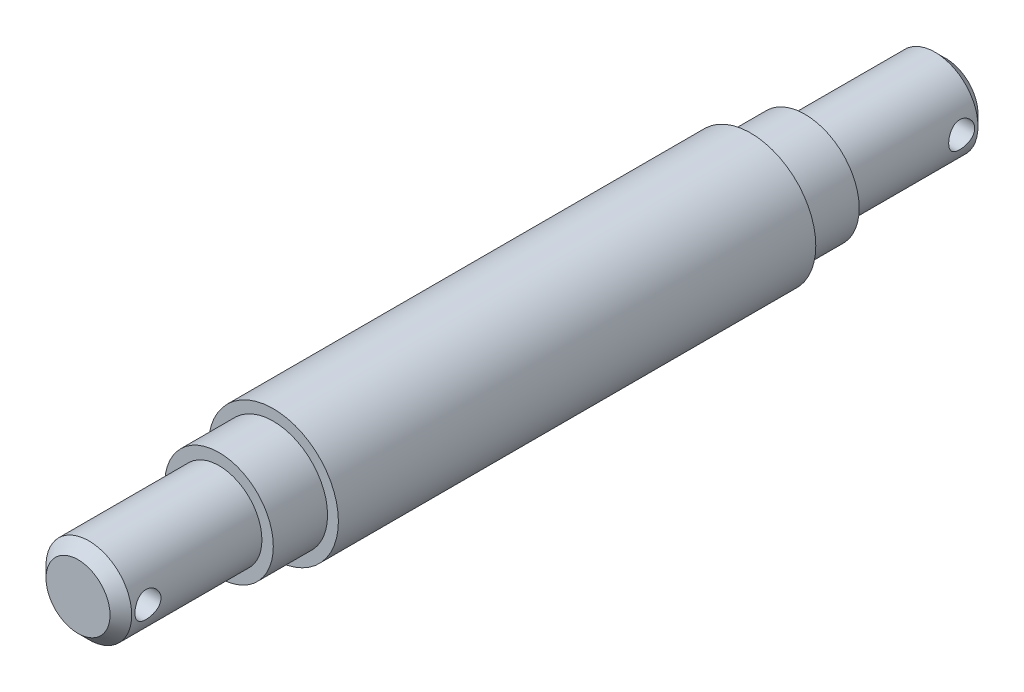
from build123d import *

# Parameters (mm, degrees)
SKETCH1_R           = 6
BOSS_EXTRUDE1_DEPTH = 22
SKETCH2_R           = 5
BOSS_EXTRUDE2_DEPTH = 5
SKETCH3_R           = 3.95
BOSS_EXTRUDE3_DEPTH = 13
SKETCH4_R           = 1.2
CUT_EXTRUDE1_DEPTH  = 6.5
CHAMFER1_SIZE       = 1
CHAMFER2_SIZE       = 1


with BuildPart() as part:
    # Sketch1 → Boss-Extrude1 (new, symmetric)
    with BuildSketch(Plane.XY):
        Circle(SKETCH1_R)
    extrude(amount=BOSS_EXTRUDE1_DEPTH, both=True)

    # Sketch2 → Boss-Extrude2 (add)
    with BuildSketch(Plane.XY.offset(22)):
        Circle(SKETCH2_R)
    boss_extrude2 = extrude(amount=BOSS_EXTRUDE2_DEPTH)

    # Sketch3 → Boss-Extrude3 (add)
    with BuildSketch(Plane.XY.offset(27)):
        with Locations(Location((0, 0, 0), (0, 0, 180))):
            Circle(SKETCH3_R)
    boss_extrude3 = extrude(amount=BOSS_EXTRUDE3_DEPTH)

    # Sketch4 → Cut-Extrude1 (cut, symmetric)
    with BuildSketch(Plane(origin=(0, 0, 0), x_dir=(0, 0, -1), z_dir=(1, 0, 0))):
        with Locations(Location((-37.5, 0, 0), (0, 0, 179.999999999))):
            Circle(SKETCH4_R)
    cut_extrude1 = extrude(amount=CUT_EXTRUDE1_DEPTH, both=True, mode=Mode.SUBTRACT)

    # Chamfer1
    chamfer1_edges = [part.edges().sort_by_distance(p)[0] for p in [
        (3.95, 0, 40),
    ]]
    chamfer(chamfer1_edges, length=CHAMFER1_SIZE)

    # Mirror1: Boss-Extrude2, Boss-Extrude3 across plane
    add(boss_extrude2.mirror(Plane.XY))
    add(boss_extrude3.mirror(Plane.XY))

    # Mirror2: Cut-Extrude1 across plane
    add(cut_extrude1.mirror(Plane.XY), mode=Mode.SUBTRACT)

    # Chamfer2
    chamfer2_edges = [part.edges().sort_by_distance(p)[0] for p in [
        (3.95, 0, -40),
    ]]
    chamfer(chamfer2_edges, length=CHAMFER2_SIZE)


solid = part.part
